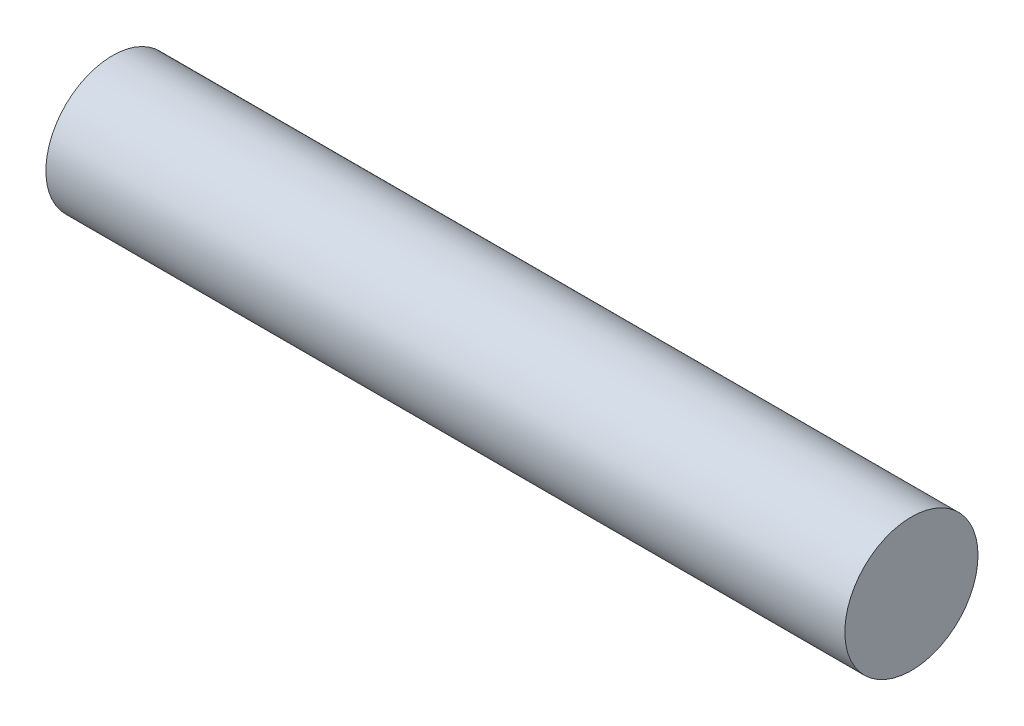
from build123d import *

# Parameters (mm, degrees)
SKETCH1_R           = 25
BOSS_EXTRUDE1_DEPTH = 300


with BuildPart() as part:
    # Sketch1 → Boss-Extrude1 (new body)
    with BuildSketch(Plane(origin=(0, 0, 0), x_dir=(0, 0, -1), z_dir=(1, 0, 0))):
        with Locations((-68.191852528, 15.152937976)):
            Circle(SKETCH1_R)
    extrude(amount=BOSS_EXTRUDE1_DEPTH)


solid = part.part
